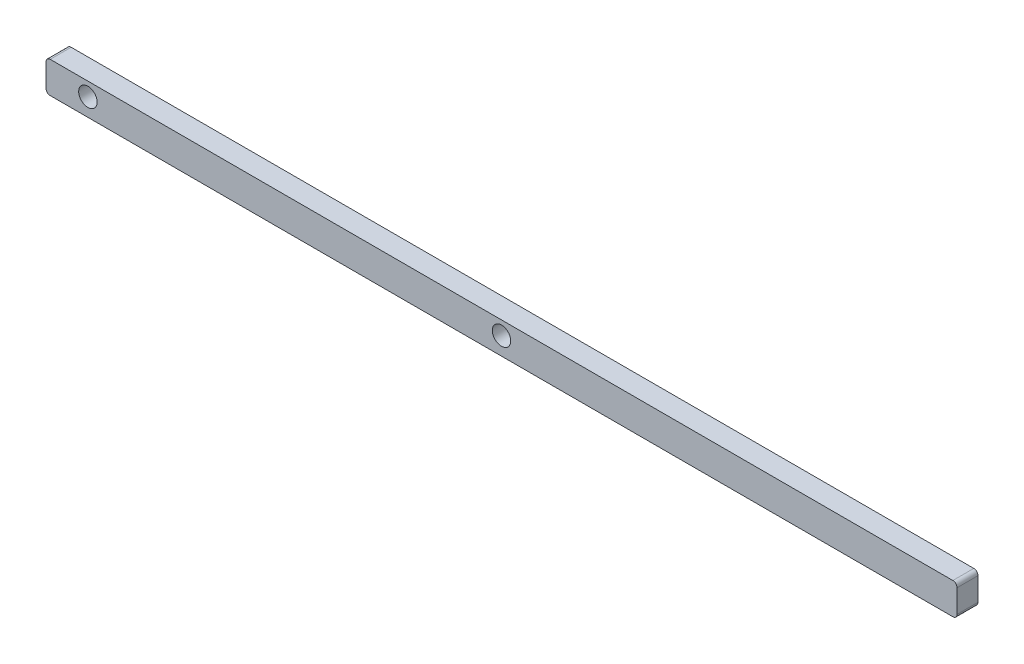
from build123d import *

# Parameters (mm, degrees)
SKETCH1_W           = 552.45
SKETCH1_H           = 19.05
SKETCH1_R           = 5.588
BOSS_EXTRUDE1_DEPTH = 6.35
FILLET1_R           = 2.54


with BuildPart() as part:
    # Sketch1 → Boss-Extrude1 (new, symmetric)
    with BuildSketch(Plane.XY):
        with Locations((0, -1.257859134)):
            Rectangle(SKETCH1_W, SKETCH1_H)
        Circle(SKETCH1_R, mode=Mode.SUBTRACT)
        with Locations((-250.825, 0)):
            Circle(SKETCH1_R, mode=Mode.SUBTRACT)
    extrude(amount=BOSS_EXTRUDE1_DEPTH, both=True)

    # Fillet1
    fillet1_edges = [part.edges().sort_by_distance(p)[0] for p in [
        (276.225, -10.782859134, 0),
        (-276.225, -10.782859134, 0),
        (-276.225, 8.267140866, 0),
        (276.225, 8.267140866, 0),
    ]]
    fillet(fillet1_edges, radius=FILLET1_R)


solid = part.part
